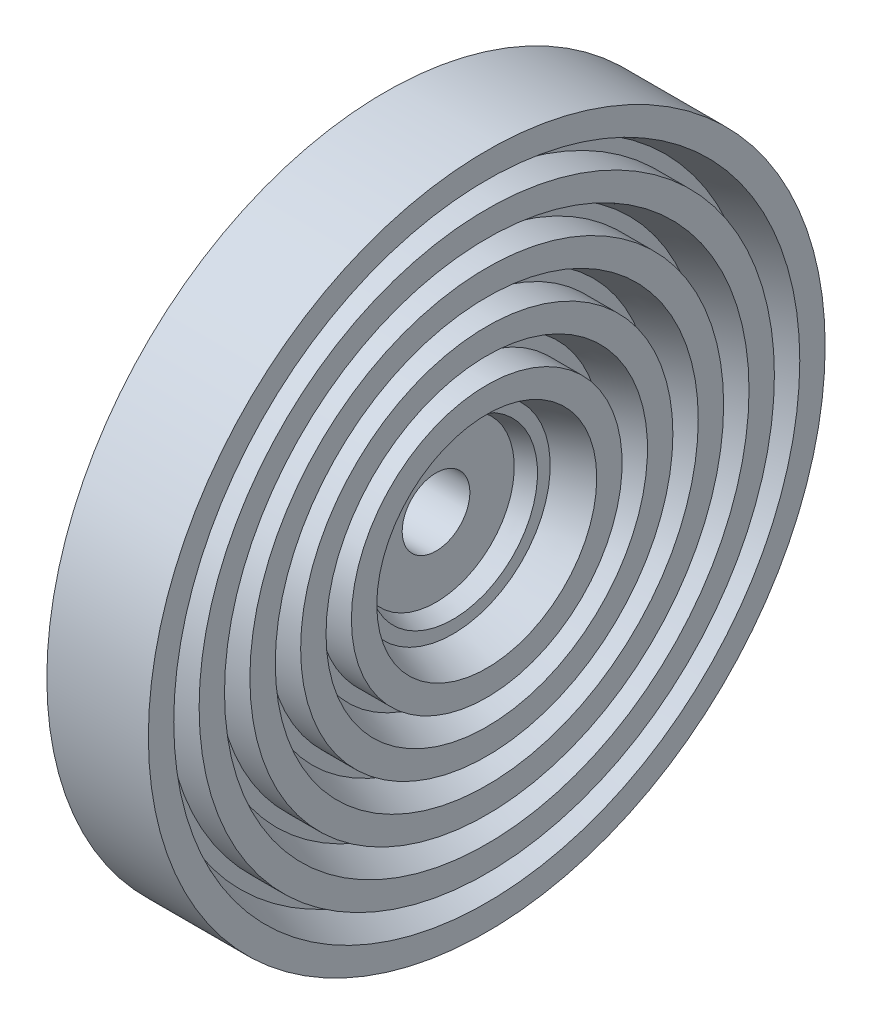
from build123d import *


with BuildPart() as part:
    # Schizzo3 → Rivoluzione1 (revolve)
    with BuildSketch(Plane.XY, mode=Mode.PRIVATE) as rivoluzione1_sk:
        Polygon((0, 0), (0, 18), (6, 18), (6, 16.5), (4, 15.75), (4, 15), (6, 15), (6, 13.5), (4, 12.75), (4, 12), (6, 12), (6, 10.5), (4, 9.75), (4, 9), (6, 9), (6, 7.5), (4, 6.75), (4, 6), (6, 6), (6, 4.5), (4, 3.75), (4, 3), (3, 2.625), (3, 0), align=None)
    revolve(rivoluzione1_sk.sketch.rotate(Axis((-0.664443358, -2, 0), (1, 0, 0)), 90), axis=Axis((-0.664443358, -2, 0), (1, 0, 0)))


solid = part.part
